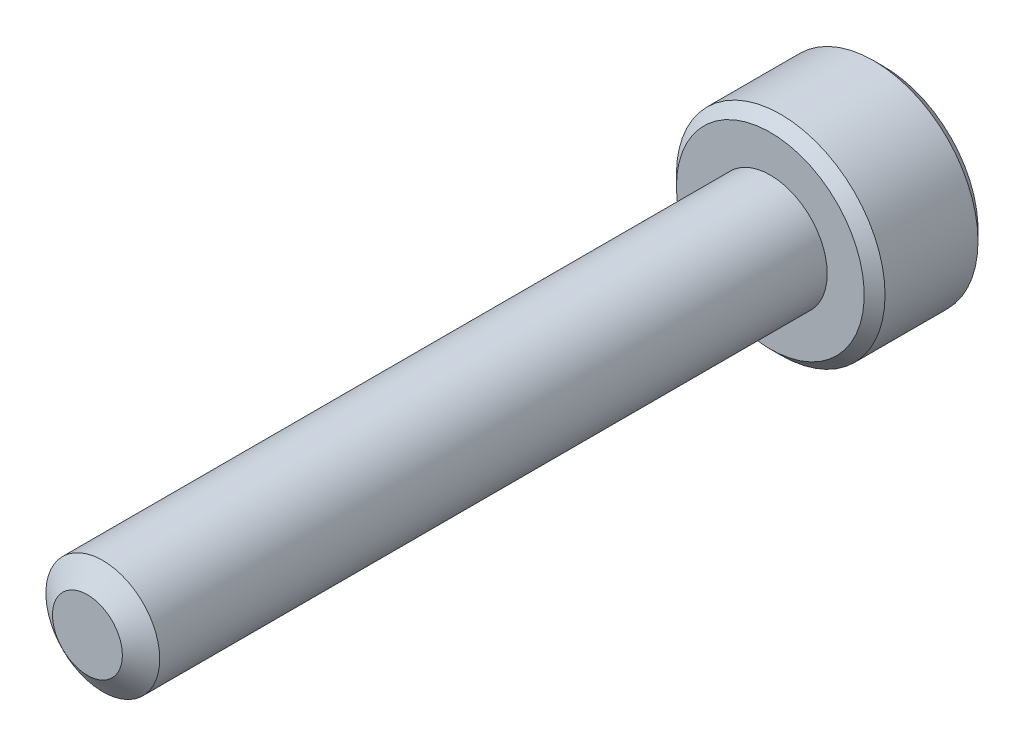
from build123d import *

# Parameters (mm, degrees)
SKETCH1_R          = 1.5
EXTRUDE1_DEPTH     = 18
SKETCH6_R          = 2.75
EXTRUDE2_DEPTH     = 3
CUT_EXTRUDE1_DEPTH = 1.875
CHAMFER1_SIZE      = 0.275


with BuildPart() as part:
    # Sketch1 → Extrude1 (new body)
    with BuildSketch(Plane.XY):
        Circle(SKETCH1_R)
    extrude(amount=-EXTRUDE1_DEPTH)

    # Sketch4 → Cut-Revolve1 (revolve, cut)
    with BuildSketch(Plane(origin=(0, 0, 0), x_dir=(0, 0, -1), z_dir=(1, 0, 0)), mode=Mode.PRIVATE) as cut_revolve1_sk:
        Polygon((0.405251783, 1.5), (0, 0.921240474), (0, 1.5), align=None)
    revolve(cut_revolve1_sk.sketch.rotate(Axis((0, 0, 0), (0, 0, -1)), 90), axis=Axis((0, 0, 0), (0, 0, -1)), mode=Mode.SUBTRACT)

    # Sketch6 → Extrude2 (add)
    with BuildSketch(Plane(origin=(0, 0, -18), x_dir=(-1, 0, 0), z_dir=(0, 0, -1))):
        Circle(SKETCH6_R)
    extrude(amount=EXTRUDE2_DEPTH)

    # Sketch7 → Cut-Extrude1 (cut)
    with BuildSketch(Plane(origin=(0, 0, -21), x_dir=(-1, 0, 0), z_dir=(0, 0, -1))):
        Polygon((0, 1.443375673), (-1.25, 0.721687836), (-1.25, -0.721687836), (0, -1.443375673), (1.25, -0.721687836), (1.25, 0.721687836), align=None)
    extrude(amount=-CUT_EXTRUDE1_DEPTH, mode=Mode.SUBTRACT)

    # Cut-Extrude2 cone 1 section (through the dimple's axis) → Cut-Extrude2 (revolve, cut)
    with BuildSketch(Plane(origin=(0, 0, -21), x_dir=(0, 1, 0), z_dir=(1, 0, 0))):
        Polygon((0, 0), (1.443375673, 0), (0, 1.443375673), align=None)
    revolve(axis=Axis((0, 0, -21), (0, 0, 1)), mode=Mode.SUBTRACT)

    # Chamfer1
    chamfer1_edges = [part.edges().sort_by_distance(p)[0] for p in [
        (2.75, 0, -18),
        (2.75, 0, -21),
    ]]
    chamfer(chamfer1_edges, length=CHAMFER1_SIZE)


solid = part.part
